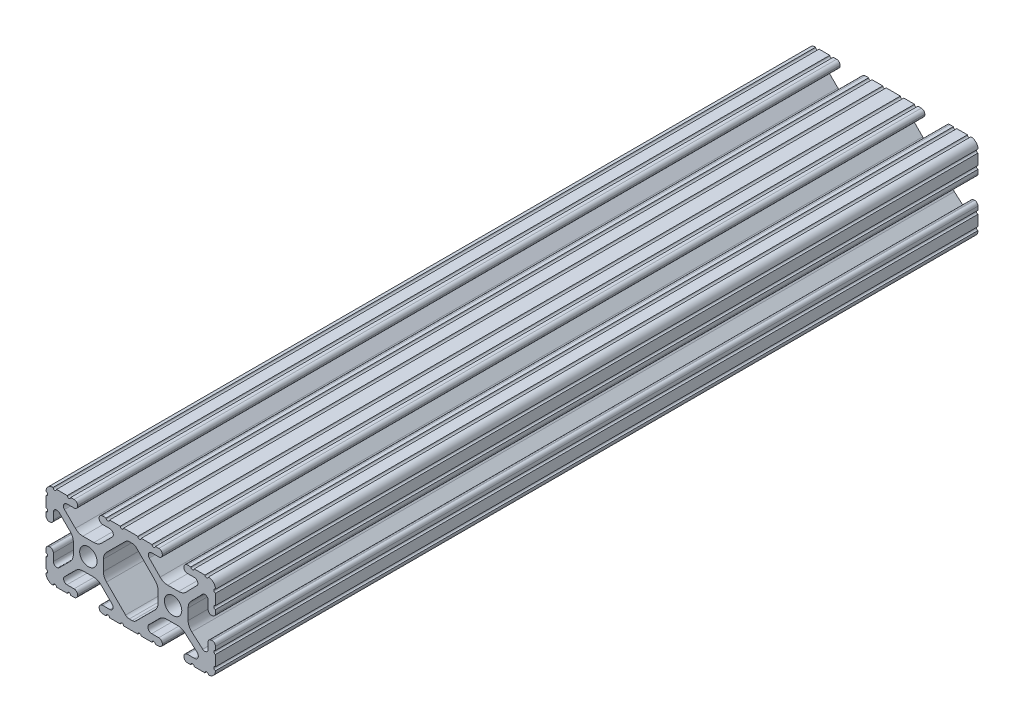
from build123d import *

# Parameters (mm, degrees)
SKETCH1_R           = 2.6035
BOSS_EXTRUDE1_DEPTH = 114.3


with BuildPart() as part:
    # Sketch1 → Boss-Extrude1 (new, symmetric)
    with BuildSketch(Plane.XY):
        with BuildLine():
            Line((18.01710265, 12.7), (16.98745015, 12.7))
            ThreePointArc((16.98745015, 12.7), (16.245730386, 12.392769614), (15.9385, 11.65104985))
            Line((15.9385, 11.65104985), (15.9385, 11.53922))
            ThreePointArc((15.9385, 11.53922), (16.245750844, 10.797450844), (16.98752, 10.4902))
            Line((16.98752, 10.4902), (19.116384363, 10.4902))
            ThreePointArc((19.116384363, 10.4902), (20.052502933, 9.869096983), (19.844087081, 8.765172272))
            Line((19.844087081, 8.765172272), (16.618993479, 5.455112286))
            ThreePointArc((16.618993479, 5.455112286), (15.578994274, 4.745442459), (14.344932584, 4.4958))
            Line((14.344932584, 4.4958), (11.083317835, 4.4958))
            ThreePointArc((11.083317835, 4.4958), (9.854330953, 4.743306833), (8.816955189, 5.447238587))
            Line((8.816955189, 5.447238587), (5.564154119, 8.762652677))
            ThreePointArc((5.564154119, 8.762652677), (5.352591412, 9.867473037), (6.289393385, 10.4902))
            Line((6.289393385, 10.4902), (8.41248, 10.4902))
            ThreePointArc((8.41248, 10.4902), (9.154249156, 10.797450844), (9.4615, 11.53922))
            Line((9.4615, 11.53922), (9.4615, 11.65104985))
            ThreePointArc((9.4615, 11.65104985), (9.154269614, 12.392769614), (8.41254985, 12.7))
            Line((8.41254985, 12.7), (7.38288465, 12.7))
            ThreePointArc((7.38288465, 12.7), (6.87488465, 12.192), (6.36688465, 12.7))
            Line((6.36688465, 12.7), (3.14958095, 12.7))
            ThreePointArc((3.14958095, 12.7), (2.64158095, 12.192), (2.13358095, 12.7))
            Line((2.13358095, 12.7), (-2.13358095, 12.7))
            ThreePointArc((-2.13358095, 12.7), (-2.64158095, 12.192), (-3.14958095, 12.7))
            Line((-3.14958095, 12.7), (-6.36689735, 12.7))
            ThreePointArc((-6.36689735, 12.7), (-6.87489735, 12.192), (-7.38289735, 12.7))
            Line((-7.38289735, 12.7), (-8.41254985, 12.7))
            ThreePointArc((-8.41254985, 12.7), (-9.154269614, 12.392769614), (-9.4615, 11.65104985))
            Line((-9.4615, 11.65104985), (-9.4615, 11.53922))
            ThreePointArc((-9.4615, 11.53922), (-9.154249156, 10.797450844), (-8.41248, 10.4902))
            Line((-8.41248, 10.4902), (-6.283641037, 10.4902))
            ThreePointArc((-6.283641037, 10.4902), (-5.297291557, 9.829633109), (-5.532576693, 8.666071843))
            Line((-5.532576693, 8.666071843), (-8.809985098, 5.416263103))
            ThreePointArc((-8.809985098, 5.416263103), (-9.836720513, 4.734920264), (-11.045536121, 4.4958))
            Line((-11.045536121, 4.4958), (-14.354463879, 4.4958))
            ThreePointArc((-14.354463879, 4.4958), (-15.563279487, 4.734920264), (-16.590014902, 5.416263103))
            Line((-16.590014902, 5.416263103), (-19.867423307, 8.666071843))
            ThreePointArc((-19.867423307, 8.666071843), (-20.102708443, 9.829633109), (-19.116358963, 10.4902))
            Line((-19.116358963, 10.4902), (-16.98752, 10.4902))
            ThreePointArc((-16.98752, 10.4902), (-16.245750844, 10.797450844), (-15.9385, 11.53922))
            Line((-15.9385, 11.53922), (-15.9385, 11.65104985))
            ThreePointArc((-15.9385, 11.65104985), (-16.245730386, 12.392769614), (-16.98745015, 12.7))
            Line((-16.98745015, 12.7), (-18.01711535, 12.7))
            ThreePointArc((-18.01711535, 12.7), (-18.52511535, 12.192), (-19.03311535, 12.7))
            Line((-19.03311535, 12.7), (-22.2504, 12.7))
            ThreePointArc((-22.2504, 12.7), (-22.758323491, 12.192000006), (-23.266399977, 12.699846982))
            ThreePointArc((-23.266399977, 12.699846982), (-24.782522516, 12.082522516), (-25.399846982, 10.566399977))
            ThreePointArc((-25.399846982, 10.566399977), (-24.892000006, 10.058323491), (-25.4, 9.5504))
            Line((-25.4, 9.5504), (-25.4, 6.3330836))
            ThreePointArc((-25.4, 6.3330836), (-24.892, 5.8250836), (-25.4, 5.3170836))
            Line((-25.4, 5.3170836), (-25.4, 4.237520184))
            ThreePointArc((-25.4, 4.237520184), (-25.107393763, 3.531106237), (-24.400979816, 3.2385))
            Line((-24.400979816, 3.2385), (-24.23922, 3.2385))
            ThreePointArc((-24.23922, 3.2385), (-23.497450844, 3.545750844), (-23.1902, 4.28752))
            Line((-23.1902, 4.28752), (-23.1902, 6.334741132))
            ThreePointArc((-23.1902, 6.334741132), (-22.556026952, 7.286023527), (-21.434002553, 7.066535717))
            Line((-21.434002553, 7.066535717), (-18.147950853, 3.808156468))
            ThreePointArc((-18.147950853, 3.808156468), (-17.452759693, 2.774838327), (-17.208501877, 1.553619571))
            Line((-17.208501877, 1.553619571), (-17.208501877, -1.695179196))
            ThreePointArc((-17.208501877, -1.695179196), (-17.450738657, -2.911536421), (-18.140486065, -3.942289578))
            Line((-18.140486065, -3.942289578), (-21.431579576, -7.227386226))
            ThreePointArc((-21.431579576, -7.227386226), (-22.55444896, -7.449940594), (-23.1902, -6.498002195))
            Line((-23.1902, -6.498002195), (-23.1902, -4.28752))
            ThreePointArc((-23.1902, -4.28752), (-23.497450844, -3.545750844), (-24.23922, -3.2385))
            Line((-24.23922, -3.2385), (-24.35098, -3.2385))
            ThreePointArc((-24.35098, -3.2385), (-25.092749156, -3.545750844), (-25.4, -4.28752))
            Line((-25.4, -4.28752), (-25.4, -5.3171344))
            ThreePointArc((-25.4, -5.3171344), (-24.892, -5.8251344), (-25.4, -6.3331344))
            Line((-25.4, -6.3331344), (-25.4, -9.5504))
            ThreePointArc((-25.4, -9.5504), (-24.892000006, -10.058323491), (-25.399846982, -10.566399977))
            ThreePointArc((-25.399846982, -10.566399977), (-24.782522516, -12.082522516), (-23.266399977, -12.699846982))
            ThreePointArc((-23.266399977, -12.699846982), (-22.758323491, -12.192000006), (-22.2504, -12.7))
            Line((-22.2504, -12.7), (-19.03308995, -12.7))
            ThreePointArc((-19.03308995, -12.7), (-18.52508995, -12.192), (-18.01708995, -12.7))
            Line((-18.01708995, -12.7), (-16.9874692, -12.7))
            ThreePointArc((-16.9874692, -12.7), (-16.245700044, -12.392749156), (-15.9384492, -11.65098))
            Line((-15.9384492, -11.65098), (-15.9384492, -11.53922))
            ThreePointArc((-15.9384492, -11.53922), (-16.245700044, -10.797450844), (-16.9874692, -10.4902))
            Line((-16.9874692, -10.4902), (-19.116358963, -10.4902))
            ThreePointArc((-19.116358963, -10.4902), (-20.055197748, -9.862578342), (-19.834124023, -8.755124678))
            Line((-19.834124023, -8.755124678), (-16.49660751, -5.423689618))
            ThreePointArc((-16.49660751, -5.423689618), (-15.467274017, -4.736928798), (-14.253591699, -4.4958))
            Line((-14.253591699, -4.4958), (-11.146408301, -4.4958))
            ThreePointArc((-11.146408301, -4.4958), (-9.932725983, -4.736928798), (-8.90339249, -5.423689618))
            Line((-8.90339249, -5.423689618), (-5.565875977, -8.755124678))
            ThreePointArc((-5.565875977, -8.755124678), (-5.344802252, -9.862578342), (-6.283641037, -10.4902))
            Line((-6.283641037, -10.4902), (-8.4125308, -10.4902))
            ThreePointArc((-8.4125308, -10.4902), (-9.154299956, -10.797450844), (-9.4615508, -11.53922))
            Line((-9.4615508, -11.53922), (-9.4615508, -11.65098))
            ThreePointArc((-9.4615508, -11.65098), (-9.154299956, -12.392749156), (-8.4125308, -12.7))
            Line((-8.4125308, -12.7), (-7.38287195, -12.7))
            ThreePointArc((-7.38287195, -12.7), (-6.87487195, -12.192), (-6.36687195, -12.7))
            Line((-6.36687195, -12.7), (-3.14960635, -12.7))
            ThreePointArc((-3.14960635, -12.7), (-2.64160635, -12.192), (-2.13360635, -12.7))
            Line((-2.13360635, -12.7), (2.13360635, -12.7))
            ThreePointArc((2.13360635, -12.7), (2.64159365, -12.1920127), (3.14958095, -12.7))
            Line((3.14958095, -12.7), (6.36691005, -12.7))
            ThreePointArc((6.36691005, -12.7), (6.87491005, -12.192), (7.38291005, -12.7))
            Line((7.38291005, -12.7), (8.4125308, -12.7))
            ThreePointArc((8.4125308, -12.7), (9.154299956, -12.392749156), (9.4615508, -11.65098))
            Line((9.4615508, -11.65098), (9.4615508, -11.53922))
            ThreePointArc((9.4615508, -11.53922), (9.154299956, -10.797450844), (8.4125308, -10.4902))
            Line((8.4125308, -10.4902), (6.289393385, -10.4902))
            ThreePointArc((6.289393385, -10.4902), (5.231590322, -9.783049717), (5.480677245, -8.535265862))
            Line((5.480677245, -8.535265862), (8.597933595, -5.423689618))
            ThreePointArc((8.597933595, -5.423689618), (9.627267088, -4.736928798), (10.840949406, -4.4958))
            Line((10.840949406, -4.4958), (14.102564155, -4.4958))
            ThreePointArc((14.102564155, -4.4958), (15.215927525, -4.697410182), (16.187895372, -5.276636531))
            Line((16.187895372, -5.276636531), (19.868247549, -8.482246082))
            ThreePointArc((19.868247549, -8.482246082), (20.188435806, -9.746879864), (19.116384363, -10.4902))
            Line((19.116384363, -10.4902), (16.9874692, -10.4902))
            ThreePointArc((16.9874692, -10.4902), (16.245700044, -10.797450844), (15.9384492, -11.53922))
            Line((15.9384492, -11.53922), (15.9384492, -11.65098))
            ThreePointArc((15.9384492, -11.65098), (16.245700044, -12.392749156), (16.9874692, -12.7))
            Line((16.9874692, -12.7), (18.01710265, -12.7))
            ThreePointArc((18.01710265, -12.7), (18.52510265, -12.192), (19.03310265, -12.7))
            Line((19.03310265, -12.7), (22.2504, -12.7))
            ThreePointArc((22.2504, -12.7), (22.758323491, -12.192000006), (23.266399977, -12.699846982))
            ThreePointArc((23.266399977, -12.699846982), (24.782522516, -12.082522516), (25.399846982, -10.566399977))
            ThreePointArc((25.399846982, -10.566399977), (24.892000006, -10.058323492), (25.4, -9.550400001))
            Line((25.4, -9.550400001), (25.4, -6.333083592))
            ThreePointArc((25.4, -6.333083592), (24.892000001, -5.825083593), (25.4, -5.317083593))
            Line((25.4, -5.317083593), (25.4, -4.237520184))
            ThreePointArc((25.4, -4.237520184), (25.107393763, -3.531106237), (24.400979816, -3.2385))
            Line((24.400979816, -3.2385), (24.189220184, -3.2385))
            ThreePointArc((24.189220184, -3.2385), (23.482806237, -3.531106237), (23.1902, -4.237520184))
            Line((23.1902, -4.237520184), (23.1902, -6.155876159))
            ThreePointArc((23.1902, -6.155876159), (22.62232736, -7.038258539), (21.583974541, -6.886926384))
            Line((21.583974541, -6.886926384), (18.29817066, -4.024970844))
            ThreePointArc((18.29817066, -4.024970844), (17.493730985, -2.946044689), (17.208501877, -1.630807374))
            Line((17.208501877, -1.630807374), (17.208501877, 1.630807374))
            ThreePointArc((17.208501877, 1.630807374), (17.442348332, 2.82673414), (18.109440981, 3.846495088))
            Line((18.109440981, 3.846495088), (21.526346532, 7.353420386))
            ThreePointArc((21.526346532, 7.353420386), (22.585896263, 7.574939077), (23.1902, 6.676867167))
            Line((23.1902, 6.676867167), (23.1902, 4.237520184))
            ThreePointArc((23.1902, 4.237520184), (23.482806237, 3.531106237), (24.189220184, 3.2385))
            Line((24.189220184, 3.2385), (24.400979816, 3.2385))
            ThreePointArc((24.400979816, 3.2385), (25.107393763, 3.531106237), (25.4, 4.237520184))
            Line((25.4, 4.237520184), (25.4, 5.3170836))
            ThreePointArc((25.4, 5.3170836), (24.891949193, 5.825134407), (25.4, 6.333185215))
            Line((25.4, 6.333185215), (25.4, 9.550400015))
            ThreePointArc((25.4, 9.550400015), (24.892000013, 10.058323498), (25.399846982, 10.566399977))
            ThreePointArc((25.399846982, 10.566399977), (24.782522516, 12.082522516), (23.266399977, 12.699846982))
            ThreePointArc((23.266399977, 12.699846982), (22.758323491, 12.192000006), (22.2504, 12.7))
            Line((22.2504, 12.7), (19.03310265, 12.7))
            ThreePointArc((19.03310265, 12.7), (18.52510265, 12.192), (18.01710265, 12.7))
        make_face()
        with Locations((-12.7, 0)):
            Circle(SKETCH1_R, mode=Mode.SUBTRACT)
        with Locations((12.7, 0)):
            Circle(SKETCH1_R, mode=Mode.SUBTRACT)
        with BuildLine():
            Line((-7.259513935, -3.869413038), (-1.545748891, -9.572766749))
            ThreePointArc((-1.545748891, -9.572766749), (-1.035199478, -9.913400116), (-0.433213048, -10.033))
            Line((-0.433213048, -10.033), (0.433213048, -10.033))
            ThreePointArc((0.433213048, -10.033), (1.035199478, -9.913400116), (1.545748891, -9.572766749))
            Line((1.545748891, -9.572766749), (7.259513935, -3.869413038))
            ThreePointArc((7.259513935, -3.869413038), (7.949261343, -2.838659881), (8.191498123, -1.622302656))
            Line((8.191498123, -1.622302656), (8.191498123, 1.622302656))
            ThreePointArc((8.191498123, 1.622302656), (7.955573352, 2.823327967), (7.282860769, 3.845864069))
            Line((7.282860769, 3.845864069), (1.675572808, 9.561086461))
            ThreePointArc((1.675572808, 9.561086461), (1.161034429, 9.910236611), (0.551456936, 10.033))
            Line((0.551456936, 10.033), (-0.395199982, 10.033))
            ThreePointArc((-0.395199982, 10.033), (-0.994772524, 9.914396349), (-1.50403329, 9.576450301))
            Line((-1.50403329, 9.576450301), (-7.252049147, 3.876839553))
            ThreePointArc((-7.252049147, 3.876839553), (-7.947240307, 2.843521412), (-8.191498123, 1.622302656))
            Line((-8.191498123, 1.622302656), (-8.191498123, -1.622302656))
            ThreePointArc((-8.191498123, -1.622302656), (-7.949261343, -2.838659881), (-7.259513935, -3.869413038))
        make_face(mode=Mode.SUBTRACT)
    extrude(amount=BOSS_EXTRUDE1_DEPTH, both=True)


solid = part.part
